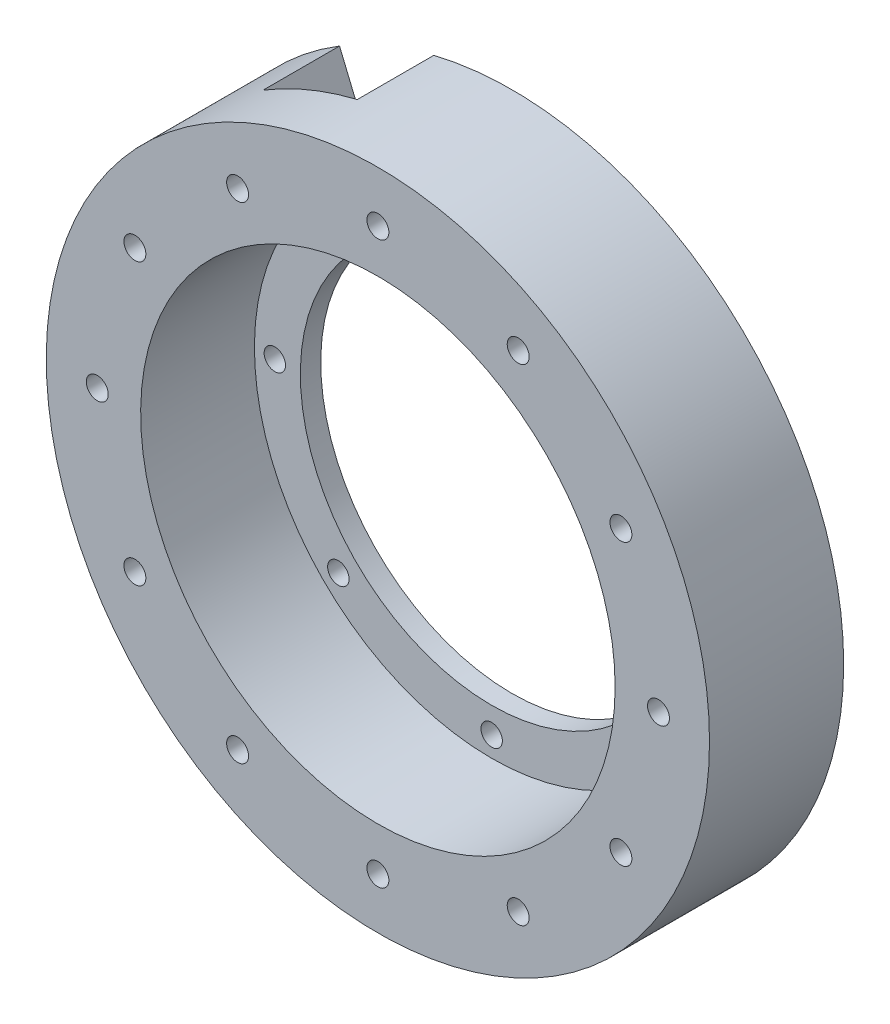
from build123d import *

# Parameters (mm, degrees)
SKETCH_1_R               = 65
EXTRUDE_1_DEPTH          = 5
SKETCH_2_R               = 65
SKETCH_2_R_2             = 46.5
EXTRUDE_2_DEPTH          = 21.3
SKETCH_3_R               = 2.1
CUT_EXTRUDE_1_DEPTH      = 21.3
SKETCH_4_R               = 37.5
CUT_EXTRUDE_2_DEPTH      = 21.3
CUT_EXTRUDE_3_DEPTH      = 15
CUT_EXTRUDE_4_DEPTH      = 95.359366255
CUT_EXTRUDE_4_DEPTH_BACK = 95.359366255
SKETCH_6_R               = 2.15
CUT_EXTRUDE_START        = -1
CUT_EXTRUDE_5_DEPTH      = 1


with BuildPart() as part:
    # 草图1 → 凸台-拉伸1 (new body)
    with BuildSketch(Plane.XY):
        Circle(SKETCH_1_R)
    extrude(amount=EXTRUDE_1_DEPTH)

    # 草图2 → 凸台-拉伸2 (add)
    with BuildSketch(Plane.XY.offset(5)):
        Circle(SKETCH_2_R)
        Circle(SKETCH_2_R_2, mode=Mode.SUBTRACT)
    extrude(amount=EXTRUDE_2_DEPTH)

    # 草图3 → 切除-拉伸1 (cut)
    with BuildSketch(Plane.XY.offset(5)):
        with Locations((0, 42.5)):
            Circle(SKETCH_3_R)
        with Locations((30.0520382, 30.0520382)):
            Circle(SKETCH_3_R)
        with Locations((42.5, 0)):
            Circle(SKETCH_3_R)
        with Locations((30.0520382, -30.0520382)):
            Circle(SKETCH_3_R)
        with Locations((0, -42.5)):
            Circle(SKETCH_3_R)
        with Locations((-30.0520382, -30.0520382)):
            Circle(SKETCH_3_R)
        with Locations((-42.5, 0)):
            Circle(SKETCH_3_R)
        with Locations((-30.0520382, 30.0520382)):
            Circle(SKETCH_3_R)
    extrude(amount=-CUT_EXTRUDE_1_DEPTH, mode=Mode.SUBTRACT)

    # 草图4 → 切除-拉伸2 (cut)
    with BuildSketch(Plane(origin=(0, 0, 0), x_dir=(-1, 0, 0), z_dir=(0, 0, -1))):
        Circle(SKETCH_4_R)
    extrude(amount=-CUT_EXTRUDE_2_DEPTH, mode=Mode.SUBTRACT)

    # 草图5 → 切除-拉伸3 (cut)
    with BuildSketch(Plane(origin=(0, 0, 0), x_dir=(-1, 0, 0), z_dir=(0, 0, -1))):
        Polygon((34.449558984, 57.03733322), (19.236184468, 20.308998132), (0.758593817, 27.96266678), (15.971968334, 64.691001868), align=None)
    extrude(amount=-CUT_EXTRUDE_3_DEPTH, mode=Mode.SUBTRACT)

    # 草图6 → 切除-拉伸4 (cut, two sides: drawn at the far end of the back side and taken through both)
    with BuildSketch(Plane.XY.offset(5).offset(-CUT_EXTRUDE_4_DEPTH_BACK)):
        with Locations((0, 55)):
            Circle(SKETCH_6_R)
        with Locations((27.5, 47.631397208)):
            Circle(SKETCH_6_R)
        with Locations((47.631397208, 27.5)):
            Circle(SKETCH_6_R)
        with Locations((55, 0)):
            Circle(SKETCH_6_R)
        with Locations((47.631397208, -27.5)):
            Circle(SKETCH_6_R)
        with Locations((27.5, -47.631397208)):
            Circle(SKETCH_6_R)
        with Locations((0, -55)):
            Circle(SKETCH_6_R)
        with Locations((-27.5, -47.631397208)):
            Circle(SKETCH_6_R)
        with Locations((-47.631397208, -27.5)):
            Circle(SKETCH_6_R)
        with Locations((-55, 0)):
            Circle(SKETCH_6_R)
        with Locations((-47.631397208, 27.5)):
            Circle(SKETCH_6_R)
        with Locations(Location((-27.5, 47.631397208, 0), (0, 0, 180))):
            Circle(SKETCH_6_R)
    extrude(amount=CUT_EXTRUDE_4_DEPTH + CUT_EXTRUDE_4_DEPTH_BACK, mode=Mode.SUBTRACT)

    # 草图7 → 切除-拉伸5 (cut)
    with BuildSketch(Plane.XY.offset(5).offset(CUT_EXTRUDE_START)):
        with BuildLine():
            Line((-23.069770834, 29.564094332), (-26.617216434, 38.128385611))
            ThreePointArc((-26.617216434, 38.128385611), (17.794779605, -42.960398262), (-8.139625784, 45.782054258))
            Line((-8.139625784, 45.782054258), (-4.592180184, 37.217762979))
            ThreePointArc((-4.592180184, 37.217762979), (14.350628714, -34.645482469), (-23.069770834, 29.564094332))
        make_face()
    extrude(amount=CUT_EXTRUDE_5_DEPTH, mode=Mode.SUBTRACT)


solid = part.part
